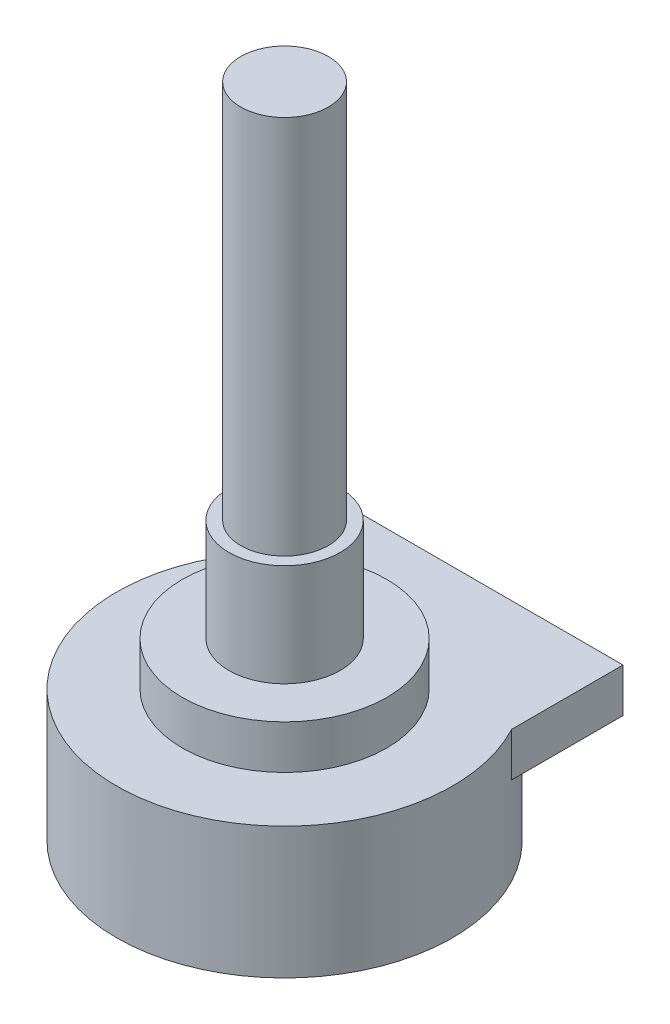
from build123d import *

# Parameters (mm, degrees)
SKETCH1_R           = 7
BOSS_EXTRUDE1_DEPTH = 9
SKETCH1_3_R         = 7
SKETCH1_3_R_2       = 3.81
BOSS_EXTRUDE2_DEPTH = 12
SKETCH1_4_R         = 3.81
SKETCH1_4_R_2       = 3
BOSS_EXTRUDE3_DEPTH = 19
SKETCH1_5_R         = 3
BOSS_EXTRUDE4_DEPTH = 45
CUT_EXTRUDE1_DEPTH  = 6


with BuildPart() as part:
    # Sketch1 → Boss-Extrude1 (new body)
    with BuildSketch(Plane(origin=(0, 0, 0), x_dir=(1, 0, 0), z_dir=(0, 1, 0))):
        with BuildLine():
            Line((11.2776, 8.7884), (-9.0424, 8.7884))
            Line((-9.0424, 8.7884), (-9.0424, 1.1684))
            ThreePointArc((-9.0424, 1.1684), (1.1176, -15.719029814), (11.2776, 1.1684))
            Line((11.2776, 1.1684), (11.2776, 8.7884))
        make_face()
        with Locations((1.1176, -4.219029814)):
            Circle(SKETCH1_R, mode=Mode.SUBTRACT)
    extrude(amount=BOSS_EXTRUDE1_DEPTH)

    # Sketch1<3> → Boss-Extrude2 (add)
    with BuildSketch(Plane(origin=(0, 0, 0), x_dir=(1, 0, 0), z_dir=(0, 1, 0))):
        with Locations((1.1176, -4.219029814)):
            Circle(SKETCH1_3_R)
        with Locations((1.1176, -4.219029814)):
            Circle(SKETCH1_3_R_2, mode=Mode.SUBTRACT)
    extrude(amount=BOSS_EXTRUDE2_DEPTH)

    # Sketch1<4> → Boss-Extrude3 (add)
    with BuildSketch(Plane(origin=(0, 0, 0), x_dir=(1, 0, 0), z_dir=(0, 1, 0))):
        with Locations((1.1176, -4.219029814)):
            Circle(SKETCH1_4_R)
        with Locations((1.1176, -4.219029814)):
            Circle(SKETCH1_4_R_2, mode=Mode.SUBTRACT)
    extrude(amount=BOSS_EXTRUDE3_DEPTH)

    # Sketch1<5> → Boss-Extrude4 (add)
    with BuildSketch(Plane(origin=(0, 0, 0), x_dir=(1, 0, 0), z_dir=(0, 1, 0))):
        with Locations((1.1176, -4.219029814)):
            Circle(SKETCH1_5_R)
    extrude(amount=BOSS_EXTRUDE4_DEPTH)

    # Sketch2 → Cut-Extrude1 (cut)
    with BuildSketch(Plane(origin=(0, 0, 0), x_dir=(-1, 0, 0), z_dir=(0, -1, 0))):
        with BuildLine():
            Line((9.0424, 1.1684), (9.0424, 8.7884))
            Line((9.0424, 8.7884), (-11.2776, 8.7884))
            Line((-11.2776, 8.7884), (-11.2776, 1.1684))
            ThreePointArc((-11.2776, 1.1684), (-1.1176, 7.280970186), (9.0424, 1.1684))
        make_face()
    extrude(amount=-CUT_EXTRUDE1_DEPTH, mode=Mode.SUBTRACT)


solid = part.part
